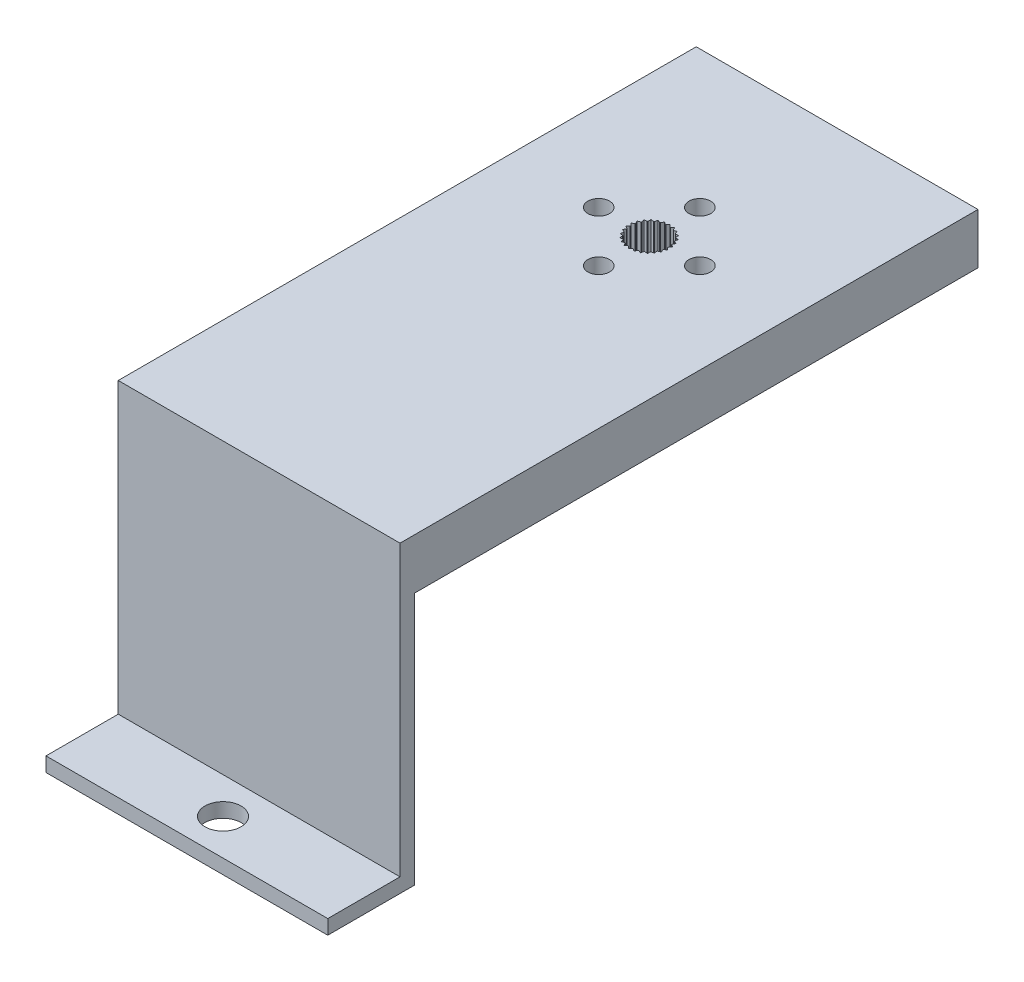
from build123d import *
from build123d.topology import SkipClean

# Parameters (mm, degrees)
BOSS_EXTRUDE1_DEPTH      = 19.5
CUT_EXTRUDE2_DEPTH       = 40
SKETCH7_W                = 5.1
SKETCH7_H                = 19.8
BOSS_EXTRUDE3_DEPTH      = 36.5
BOSS_EXTRUDE6_DEPTH      = 2
BOSS_EXTRUDE6_DEPTH_BACK = 5
SKETCH10_W               = 39
SKETCH10_H               = 60
SKETCH14_R               = 2.5
CUT_EXTRUDE4_DEPTH       = 5
SKETCH20_W               = 39
SKETCH20_H               = 7
BOSS_EXTRUDE7_DEPTH      = 20
CUT_EXTRUDE10_DEPTH      = 84.930030382
CUT_EXTRUDE10_DEPTH_BACK = 84.930030382
SKETCH21_R               = 1.5
CUT_EXTRUDE11_DEPTH      = 91.470989825
CUT_EXTRUDE11_DEPTH_BACK = 91.470989825
SKETCH22_W               = 19.8
SKETCH22_H               = 23


with BuildPart() as part:
    # Sketch3 → Boss-Extrude1 (new, symmetric)
    with BuildSketch(Plane(origin=(0, 0, 0), x_dir=(0, 0, -1), z_dir=(1, 0, 0))):
        Polygon((0, 38.5), (-60, 38.5), (-60, 2), (-70, 2), (-70, 0), (-58, 0), (-58, 36.5), (0, 36.5), align=None)
    extrude(amount=BOSS_EXTRUDE1_DEPTH, both=True)

    # Sketch5 → Cut-Extrude2 (cut)
    with BuildSketch(Plane(origin=(0, 0, 0), x_dir=(1, 0, 0), z_dir=(0, 1, 0))):
        with BuildLine():
            ThreePointArc((-0.262912611, -3.413327048), (0, -8.6), (0.262912611, -3.413327048))
            Line((0.262912611, -3.413327048), (0, -3.1))
            Line((0, -3.1), (-0.262912611, -3.413327048))
        make_face()
        with BuildLine():
            ThreePointArc((-0.874304204, -3.551410169), (-0.622220727, -3.475551275), (-0.363758508, -3.425571957))
            Line((-0.363758508, -3.425571957), (-0.694015426, -3.184268729))
            Line((-0.694015426, -3.184268729), (-0.874304204, -3.551410169))
        make_face()
        with BuildLine():
            ThreePointArc((-1.434884414, -3.831796431), (-1.208280247, -3.697814333), (-0.969289304, -3.587433266))
            Line((-0.969289304, -3.587433266), (-1.347697199, -3.432177526))
            Line((-1.347697199, -3.432177526), (-1.434884414, -3.831796431))
        make_face()
        with BuildLine():
            ThreePointArc((-1.912074359, -4.238190803), (-1.724118911, -4.053872055), (-1.518488529, -3.889504184))
            Line((-1.518488529, -3.889504184), (-1.923055709, -3.82931883))
            Line((-1.923055709, -3.82931883), (-1.912074359, -4.238190803))
        make_face()
        with BuildLine():
            ThreePointArc((-2.278141491, -4.746975122), (-2.139758051, -4.523031658), (-1.97943872, -4.314229448))
            Line((-1.97943872, -4.314229448), (-2.386653211, -4.352612234))
            Line((-2.386653211, -4.352612234), (-2.278141491, -4.746975122))
        make_face()
        with BuildLine():
            ThreePointArc((-2.511811321, -5.328580692), (-2.431042231, -5.078027294), (-2.325351128, -4.836925569))
            Line((-2.325351128, -4.836925569), (-2.711547104, -4.971645828))
            Line((-2.711547104, -4.971645828), (-2.511811321, -5.328580692))
        make_face()
        with BuildLine():
            ThreePointArc((-2.599503807, -5.949206711), (-2.581043073, -5.686604631), (-2.53612258, -5.427215348))
            Line((-2.53612258, -5.427215348), (-2.878855735, -5.650443627))
            Line((-2.878855735, -5.650443627), (-2.599503807, -5.949206711))
        make_face()
        with BuildLine():
            ThreePointArc((-2.53612258, -6.572784652), (-2.581043073, -6.313395369), (-2.599503807, -6.050793289))
            Line((-2.599503807, -6.050793289), (-2.878855735, -6.349556373))
            Line((-2.878855735, -6.349556373), (-2.53612258, -6.572784652))
        make_face()
        with BuildLine():
            ThreePointArc((-2.325351128, -7.163074431), (-2.431042231, -6.921972706), (-2.511811321, -6.671419308))
            Line((-2.511811321, -6.671419308), (-2.711547104, -7.028354172))
            Line((-2.711547104, -7.028354172), (-2.325351128, -7.163074431))
        make_face()
        with BuildLine():
            ThreePointArc((-1.97943872, -7.685770552), (-2.139758051, -7.476968342), (-2.278141491, -7.253024878))
            Line((-2.278141491, -7.253024878), (-2.386653211, -7.647387766))
            Line((-2.386653211, -7.647387766), (-1.97943872, -7.685770552))
        make_face()
        with BuildLine():
            ThreePointArc((-1.518488529, -8.110495816), (-1.724118911, -7.946127945), (-1.912074359, -7.761809197))
            Line((-1.912074359, -7.761809197), (-1.923055709, -8.17068117))
            Line((-1.923055709, -8.17068117), (-1.518488529, -8.110495816))
        make_face()
        with BuildLine():
            ThreePointArc((-0.969289304, -8.412566734), (-1.208280247, -8.302185667), (-1.434884414, -8.168203569))
            Line((-1.434884414, -8.168203569), (-1.347697199, -8.567822474))
            Line((-1.347697199, -8.567822474), (-0.969289304, -8.412566734))
        make_face()
        with BuildLine():
            Line((-0.694015426, -8.815731271), (-0.363758508, -8.574428043))
            ThreePointArc((-0.363758508, -8.574428043), (-0.622220727, -8.524448725), (-0.874304204, -8.448589831))
            Line((-0.874304204, -8.448589831), (-0.694015426, -8.815731271))
        make_face()
        with BuildLine():
            Line((0, -8.9), (0.262912611, -8.586672952))
            ThreePointArc((0.262912611, -8.586672952), (0, -8.6), (-0.262912611, -8.586672952))
            Line((-0.262912611, -8.586672952), (0, -8.9))
        make_face()
        with BuildLine():
            Line((0.694015426, -8.815731271), (0.874304204, -8.448589831))
            ThreePointArc((0.874304204, -8.448589831), (0.622220727, -8.524448725), (0.363758508, -8.574428043))
            Line((0.363758508, -8.574428043), (0.694015426, -8.815731271))
        make_face()
        with BuildLine():
            Line((1.347697199, -8.567822474), (1.434884414, -8.168203569))
            ThreePointArc((1.434884414, -8.168203569), (1.208280247, -8.302185667), (0.969289304, -8.412566734))
            Line((0.969289304, -8.412566734), (1.347697199, -8.567822474))
        make_face()
        with BuildLine():
            Line((1.923055709, -8.17068117), (1.912074359, -7.761809197))
            ThreePointArc((1.912074359, -7.761809197), (1.724118911, -7.946127945), (1.518488529, -8.110495816))
            Line((1.518488529, -8.110495816), (1.923055709, -8.17068117))
        make_face()
        with BuildLine():
            Line((2.386653211, -7.647387766), (2.278141491, -7.253024878))
            ThreePointArc((2.278141491, -7.253024878), (2.139758051, -7.476968342), (1.97943872, -7.685770552))
            Line((1.97943872, -7.685770552), (2.386653211, -7.647387766))
        make_face()
        with BuildLine():
            Line((2.711547104, -7.028354172), (2.511811321, -6.671419308))
            ThreePointArc((2.511811321, -6.671419308), (2.431042231, -6.921972706), (2.325351128, -7.163074431))
            Line((2.325351128, -7.163074431), (2.711547104, -7.028354172))
        make_face()
        with BuildLine():
            Line((2.878855735, -6.349556373), (2.599503807, -6.050793289))
            ThreePointArc((2.599503807, -6.050793289), (2.581043073, -6.313395369), (2.53612258, -6.572784652))
            Line((2.53612258, -6.572784652), (2.878855735, -6.349556373))
        make_face()
        with BuildLine():
            Line((0.874304204, -3.551410169), (0.694015426, -3.184268729))
            Line((0.694015426, -3.184268729), (0.363758508, -3.425571957))
            ThreePointArc((0.363758508, -3.425571957), (0.622220727, -3.475551275), (0.874304204, -3.551410169))
        make_face()
        with BuildLine():
            Line((1.347697199, -3.432177526), (0.969289304, -3.587433266))
            ThreePointArc((0.969289304, -3.587433266), (1.208280247, -3.697814333), (1.434884414, -3.831796431))
            Line((1.434884414, -3.831796431), (1.347697199, -3.432177526))
        make_face()
        with BuildLine():
            Line((1.923055709, -3.82931883), (1.518488529, -3.889504184))
            ThreePointArc((1.518488529, -3.889504184), (1.724118911, -4.053872055), (1.912074359, -4.238190803))
            Line((1.912074359, -4.238190803), (1.923055709, -3.82931883))
        make_face()
        with BuildLine():
            Line((2.386653211, -4.352612234), (1.97943872, -4.314229448))
            ThreePointArc((1.97943872, -4.314229448), (2.139758051, -4.523031658), (2.278141491, -4.746975122))
            Line((2.278141491, -4.746975122), (2.386653211, -4.352612234))
        make_face()
        with BuildLine():
            Line((2.711547104, -4.971645828), (2.325351128, -4.836925569))
            ThreePointArc((2.325351128, -4.836925569), (2.431042231, -5.078027294), (2.511811321, -5.328580692))
            Line((2.511811321, -5.328580692), (2.711547104, -4.971645828))
        make_face()
        with BuildLine():
            Line((2.878855735, -5.650443627), (2.53612258, -5.427215348))
            ThreePointArc((2.53612258, -5.427215348), (2.581043073, -5.686604631), (2.599503807, -5.949206711))
            Line((2.599503807, -5.949206711), (2.878855735, -5.650443627))
        make_face()
    extrude(amount=CUT_EXTRUDE2_DEPTH, mode=Mode.SUBTRACT)

    # Sketch7 → Boss-Extrude3 (add)
    with BuildSketch(Plane(origin=(0, 0, 0), x_dir=(1, 0, 0), z_dir=(0, 1, 0))):
        with Locations((-16.95, -48.1)):
            Rectangle(SKETCH7_W, SKETCH7_H)
    extrude(amount=BOSS_EXTRUDE3_DEPTH)

    # Sketch10 → Boss-Extrude6 (add, two sides: drawn at the far end of the back side and taken through both)
    with SkipClean():  # the faces are left unmerged after this step: merging them gives an invalid solid
        with BuildSketch(Plane(origin=(0, 40, 0), x_dir=(1, 0, 0), z_dir=(0, 1, 0)).offset(-BOSS_EXTRUDE6_DEPTH_BACK)):
            with Locations((0, -30)):
                Rectangle(SKETCH10_W, SKETCH10_H)
            with BuildLine():
                Line((-0.262912611, -3.413327048), (0, -3.1))
                Line((0, -3.1), (0.262912611, -3.413327048))
                ThreePointArc((0.262912611, -3.413327048), (0.313395369, -3.418956927), (0.363758508, -3.425571957))
                Line((0.363758508, -3.425571957), (0.694015426, -3.184268729))
                Line((0.694015426, -3.184268729), (0.874304204, -3.551410169))
                ThreePointArc((0.874304204, -3.551410169), (0.921972706, -3.568957769), (0.969289304, -3.587433266))
                Line((0.969289304, -3.587433266), (1.347697199, -3.432177526))
                Line((1.347697199, -3.432177526), (1.434884414, -3.831796431))
                ThreePointArc((1.434884414, -3.831796431), (1.476968342, -3.860241949), (1.518488529, -3.889504184))
                Line((1.518488529, -3.889504184), (1.923055709, -3.82931883))
                Line((1.923055709, -3.82931883), (1.912074359, -4.238190803))
                ThreePointArc((1.912074359, -4.238190803), (1.946127945, -4.275881089), (1.97943872, -4.314229448))
                Line((1.97943872, -4.314229448), (2.386653211, -4.352612234))
                Line((2.386653211, -4.352612234), (2.278141491, -4.746975122))
                ThreePointArc((2.278141491, -4.746975122), (2.302185667, -4.791719753), (2.325351128, -4.836925569))
                Line((2.325351128, -4.836925569), (2.711547104, -4.971645828))
                Line((2.711547104, -4.971645828), (2.511811321, -5.328580692))
                ThreePointArc((2.511811321, -5.328580692), (2.524448725, -5.377779273), (2.53612258, -5.427215348))
                Line((2.53612258, -5.427215348), (2.878855735, -5.650443627))
                Line((2.878855735, -5.650443627), (2.599503807, -5.949206711))
                ThreePointArc((2.599503807, -5.949206711), (2.6, -6), (2.599503807, -6.050793289))
                Line((2.599503807, -6.050793289), (2.878855735, -6.349556373))
                Line((2.878855735, -6.349556373), (2.53612258, -6.572784652))
                ThreePointArc((2.53612258, -6.572784652), (2.524448725, -6.622220727), (2.511811321, -6.671419308))
                Line((2.511811321, -6.671419308), (2.711547104, -7.028354172))
                Line((2.711547104, -7.028354172), (2.325351128, -7.163074431))
                ThreePointArc((2.325351128, -7.163074431), (2.302185667, -7.208280247), (2.278141491, -7.253024878))
                Line((2.278141491, -7.253024878), (2.386653211, -7.647387766))
                Line((2.386653211, -7.647387766), (1.97943872, -7.685770552))
                ThreePointArc((1.97943872, -7.685770552), (1.946127945, -7.724118911), (1.912074359, -7.761809197))
                Line((1.912074359, -7.761809197), (1.923055709, -8.17068117))
                Line((1.923055709, -8.17068117), (1.518488529, -8.110495816))
                ThreePointArc((1.518488529, -8.110495816), (1.476968342, -8.139758051), (1.434884414, -8.168203569))
                Line((1.434884414, -8.168203569), (1.347697199, -8.567822474))
                Line((1.347697199, -8.567822474), (0.969289304, -8.412566734))
                ThreePointArc((0.969289304, -8.412566734), (0.921972706, -8.431042231), (0.874304204, -8.448589831))
                Line((0.874304204, -8.448589831), (0.694015426, -8.815731271))
                Line((0.694015426, -8.815731271), (0.363758508, -8.574428043))
                ThreePointArc((0.363758508, -8.574428043), (0.313395369, -8.581043073), (0.262912611, -8.586672952))
                Line((0.262912611, -8.586672952), (0, -8.9))
                Line((0, -8.9), (-0.262912611, -8.586672952))
                ThreePointArc((-0.262912611, -8.586672952), (-0.313395369, -8.581043073), (-0.363758508, -8.574428043))
                Line((-0.363758508, -8.574428043), (-0.694015426, -8.815731271))
                Line((-0.694015426, -8.815731271), (-0.874304204, -8.448589831))
                ThreePointArc((-0.874304204, -8.448589831), (-0.921972706, -8.431042231), (-0.969289304, -8.412566734))
                Line((-0.969289304, -8.412566734), (-1.347697199, -8.567822474))
                Line((-1.347697199, -8.567822474), (-1.434884414, -8.168203569))
                ThreePointArc((-1.434884414, -8.168203569), (-1.476968342, -8.139758051), (-1.518488529, -8.110495816))
                Line((-1.518488529, -8.110495816), (-1.923055709, -8.17068117))
                Line((-1.923055709, -8.17068117), (-1.912074359, -7.761809197))
                ThreePointArc((-1.912074359, -7.761809197), (-1.946127945, -7.724118911), (-1.97943872, -7.685770552))
                Line((-1.97943872, -7.685770552), (-2.386653211, -7.647387766))
                Line((-2.386653211, -7.647387766), (-2.278141491, -7.253024878))
                ThreePointArc((-2.278141491, -7.253024878), (-2.302185667, -7.208280247), (-2.325351128, -7.163074431))
                Line((-2.325351128, -7.163074431), (-2.711547104, -7.028354172))
                Line((-2.711547104, -7.028354172), (-2.511811321, -6.671419308))
                ThreePointArc((-2.511811321, -6.671419308), (-2.524448725, -6.622220727), (-2.53612258, -6.572784652))
                Line((-2.53612258, -6.572784652), (-2.878855735, -6.349556373))
                Line((-2.878855735, -6.349556373), (-2.599503807, -6.050793289))
                ThreePointArc((-2.599503807, -6.050793289), (-2.6, -6), (-2.599503807, -5.949206711))
                Line((-2.599503807, -5.949206711), (-2.878855735, -5.650443627))
                Line((-2.878855735, -5.650443627), (-2.53612258, -5.427215348))
                ThreePointArc((-2.53612258, -5.427215348), (-2.524448725, -5.377779273), (-2.511811321, -5.328580692))
                Line((-2.511811321, -5.328580692), (-2.711547104, -4.971645828))
                Line((-2.711547104, -4.971645828), (-2.325351128, -4.836925569))
                ThreePointArc((-2.325351128, -4.836925569), (-2.302185667, -4.791719753), (-2.278141491, -4.746975122))
                Line((-2.278141491, -4.746975122), (-2.386653211, -4.352612234))
                Line((-2.386653211, -4.352612234), (-1.97943872, -4.314229448))
                ThreePointArc((-1.97943872, -4.314229448), (-1.946127945, -4.275881089), (-1.912074359, -4.238190803))
                Line((-1.912074359, -4.238190803), (-1.923055709, -3.82931883))
                Line((-1.923055709, -3.82931883), (-1.518488529, -3.889504184))
                ThreePointArc((-1.518488529, -3.889504184), (-1.476968342, -3.860241949), (-1.434884414, -3.831796431))
                Line((-1.434884414, -3.831796431), (-1.347697199, -3.432177526))
                Line((-1.347697199, -3.432177526), (-0.969289304, -3.587433266))
                ThreePointArc((-0.969289304, -3.587433266), (-0.921972706, -3.568957769), (-0.874304204, -3.551410169))
                Line((-0.874304204, -3.551410169), (-0.694015426, -3.184268729))
                Line((-0.694015426, -3.184268729), (-0.363758508, -3.425571957))
                ThreePointArc((-0.363758508, -3.425571957), (-0.313395369, -3.418956927), (-0.262912611, -3.413327048))
            make_face(mode=Mode.SUBTRACT)
        extrude(amount=BOSS_EXTRUDE6_DEPTH + BOSS_EXTRUDE6_DEPTH_BACK)

    # Sketch14 → Cut-Extrude4 (cut)
    with SkipClean():  # the faces are left unmerged after this step: merging them gives an invalid solid
        with BuildSketch(Plane(origin=(0, 0, 0), x_dir=(1, 0, 0), z_dir=(0, 1, 0))):
            with Locations(Location((0, -65, 0), (0, 0, 90))):
                Circle(SKETCH14_R)
        extrude(amount=CUT_EXTRUDE4_DEPTH, mode=Mode.SUBTRACT)

    # Sketch20 → Boss-Extrude7 (add)
    with SkipClean():  # the faces are left unmerged after this step: merging them gives an invalid solid
        with BuildSketch(Plane(origin=(0, 0, 0), x_dir=(-1, 0, 0), z_dir=(0, 0, -1))):
            with Locations((0, 38.5)):
                Rectangle(SKETCH20_W, SKETCH20_H)
        extrude(amount=BOSS_EXTRUDE7_DEPTH)

    # Sketch21 → Cut-Extrude10 (cut, two sides: drawn at the far end of the back side and taken through both)
    with SkipClean():  # the faces are left unmerged after this step: merging them gives an invalid solid
        with BuildSketch(Plane(origin=(0, 42, 0), x_dir=(1, 0, 0), z_dir=(0, 1, 0)).offset(-CUT_EXTRUDE10_DEPTH_BACK)):
            with Locations(Location((0, -13, 0), (0, 0, 270))):
                Circle(SKETCH21_R)
            with Locations(Location((-7, -6, 0), (0, 0, 270))):
                Circle(SKETCH21_R)
            with Locations(Location((0, 1, 0), (0, 0, 270))):
                Circle(SKETCH21_R)
            with Locations(Location((7, -6, 0), (0, 0, 270))):
                Circle(SKETCH21_R)
        extrude(amount=CUT_EXTRUDE10_DEPTH + CUT_EXTRUDE10_DEPTH_BACK, mode=Mode.SUBTRACT)

    # Sketch22 → Cut-Extrude11 (cut, two sides: drawn at the far end of the back side and taken through both)
    with SkipClean():  # the faces are left unmerged after this step: merging them gives an invalid solid
        with BuildSketch(Plane.ZY.offset(19.5).offset(-CUT_EXTRUDE11_DEPTH_BACK)):
            with Locations((48.1, 23.5)):
                Rectangle(SKETCH22_W, SKETCH22_H)
        extrude(amount=CUT_EXTRUDE11_DEPTH + CUT_EXTRUDE11_DEPTH_BACK, mode=Mode.SUBTRACT)


solid = part.part
